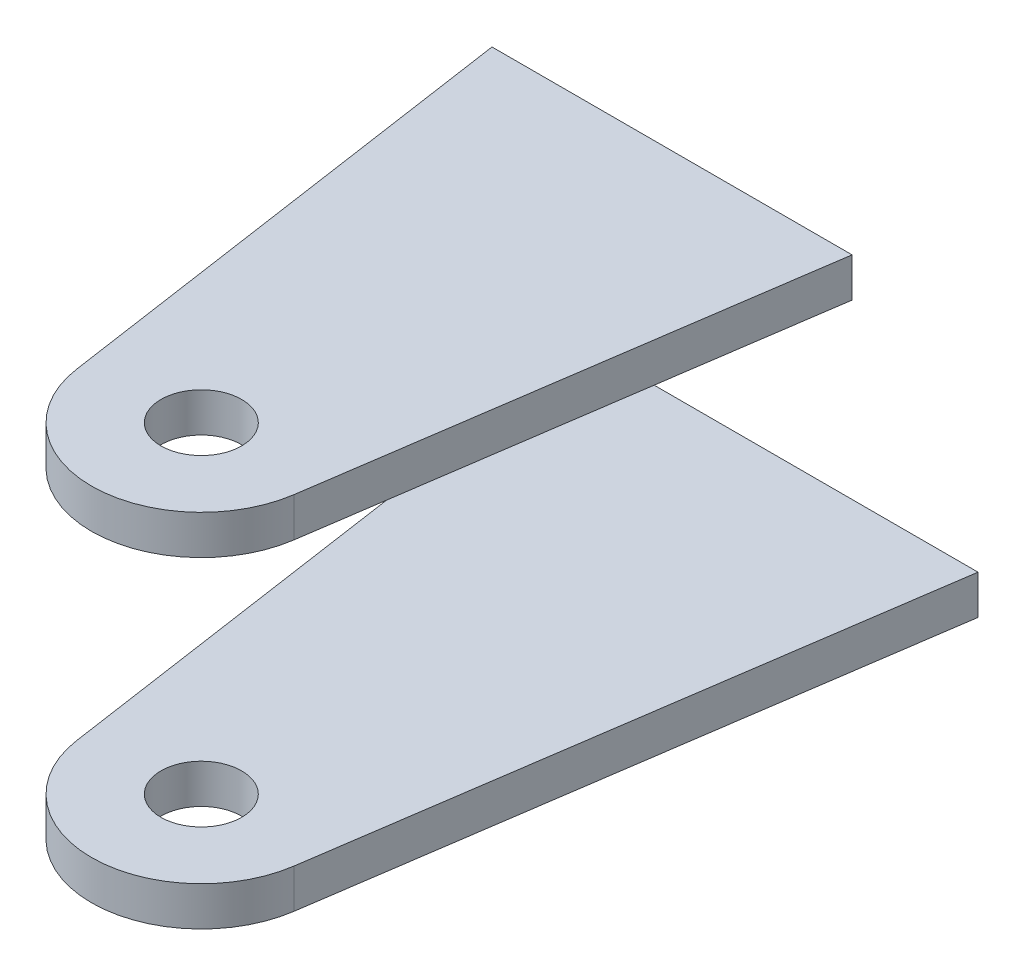
from build123d import *

# Parameters (mm, degrees)
BOSS_EXTRUDE1_START = 11.43
SKETCH2_R           = 3.2639
BOSS_EXTRUDE1_DEPTH = 3.175
BOSS_EXTRUDE2_START = -11.43
SKETCH2_3_R         = 3.2639
BOSS_EXTRUDE2_DEPTH = 3.175


with BuildPart() as part:
    # Sketch2 → Boss-Extrude1 (new body)
    with BuildSketch(Plane(origin=(0, 0, 0), x_dir=(1, 0, 0), z_dir=(0, 1, 0)).offset(BOSS_EXTRUDE1_START)):
        with BuildLine():
            ThreePointArc((-8.795950238, -1.289712918), (0, -8.89), (8.795950238, -1.289712918))
            Line((8.795950238, -1.289712918), (14.571496964, 38.1))
            Line((14.571496964, 38.1), (-14.571496964, 38.1))
            Line((-14.571496964, 38.1), (-8.795950238, -1.289712918))
        make_face()
        with Locations(Location((0, 0, 0), (0, 0, 270))):
            Circle(SKETCH2_R, mode=Mode.SUBTRACT)
    extrude(amount=BOSS_EXTRUDE1_DEPTH)


with BuildPart() as body_2:
    # Sketch2<3> → Boss-Extrude2 (new body)
    with BuildSketch(Plane(origin=(0, 0, 0), x_dir=(1, 0, 0), z_dir=(0, 1, 0)).offset(BOSS_EXTRUDE2_START)):
        with BuildLine():
            Line((-15.875, 46.99), (-8.795950238, -1.289712918))
            ThreePointArc((-8.795950238, -1.289712918), (0, -8.89), (8.795950238, -1.289712918))
            Line((8.795950238, -1.289712918), (15.875, 46.99))
            Line((15.875, 46.99), (-15.875, 46.99))
        make_face()
        with Locations(Location((0, 0, 0), (0, 0, 270))):
            Circle(SKETCH2_3_R, mode=Mode.SUBTRACT)
    extrude(amount=-BOSS_EXTRUDE2_DEPTH)


solid = Compound([part.part, body_2.part])
